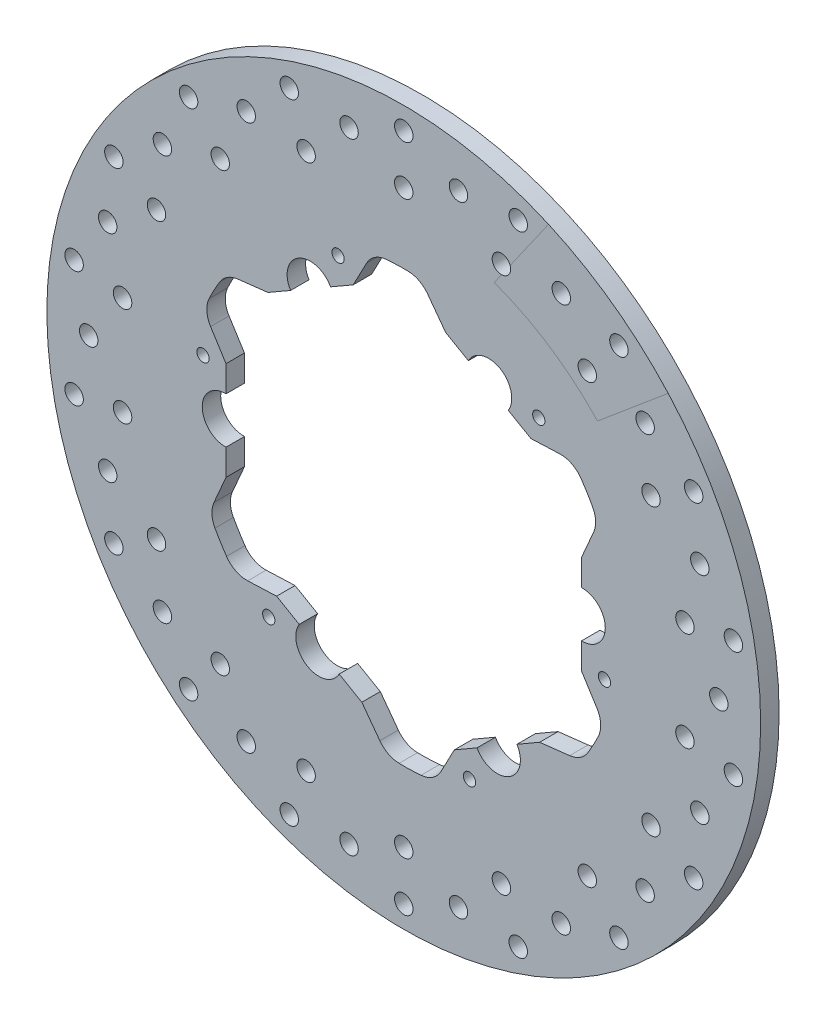
from build123d import *

# Parameters (mm, degrees)
SKETCH1_R             = 92.075
BOSS_EXTRUDE1_DEPTH   = 4.7625
FILLET1_R             = 6.35
SKETCH4_R             = 1.5875
CUT_EXTRUDE1_DEPTH    = 131.30077765
SKETCH5_R             = 2.38125
CUT_EXTRUDE2_DEPTH    = 131.30077765
FRONTPATERNCOPY_COUNT = 18


with BuildPart() as part:
    # Sketch1 → Boss-Extrude1 (new body)
    with BuildSketch(Plane.XY):
        with Locations(Location((0, 0, 0), (0, 0, 180))):
            Circle(SKETCH1_R)
        with BuildLine():
            Line((-45.8597, 4.659861673), (-45.8597, 11.409392412))
            Line((-45.8597, 11.409392412), (-51.623596361, 20.547401417))
            ThreePointArc((-51.623596361, 20.547401417), (-49.007713262, 26.180822124), (-45.779418198, 31.487081093))
            Line((-45.779418198, 31.487081093), (-35.046071586, 32.720361416))
            Line((-35.046071586, 32.720361416), (-29.200806502, 36.095126785))
            ThreePointArc((-29.200806502, 36.095126785), (-27.113011458, 44.379898214), (-18.894291413, 42.045596046))
            Line((-18.894291413, 42.045596046), (-13.04902633, 45.420361416))
            Line((-13.04902633, 45.420361416), (-8.017226572, 54.981046592))
            ThreePointArc((-8.017226572, 54.981046592), (-1.830599579, 55.532335728), (4.378903018, 55.389679676))
            Line((4.378903018, 55.389679676), (10.813628414, 46.710969004))
            Line((10.813628414, 46.710969004), (16.658893498, 43.336203635))
            ThreePointArc((16.658893498, 43.336203635), (24.877613542, 45.670505803), (26.965408587, 37.385734374))
            Line((26.965408587, 37.385734374), (32.81067367, 34.010969004))
            Line((32.81067367, 34.010969004), (43.606369789, 34.433645175))
            ThreePointArc((43.606369789, 34.433645175), (47.177113682, 29.351513604), (50.158321216, 23.902598583))
            Line((50.158321216, 23.902598583), (45.8597, 13.990607588))
            Line((45.8597, 13.990607588), (45.8597, 7.241076849))
            ThreePointArc((45.8597, 7.241076849), (51.990625, 1.290607588), (45.8597, -4.659861673))
            Line((45.8597, -4.659861673), (45.8597, -11.409392412))
            Line((45.8597, -11.409392412), (51.623596361, -20.547401417))
            ThreePointArc((51.623596361, -20.547401417), (49.007713262, -26.180822124), (45.779418198, -31.487081093))
            Line((45.779418198, -31.487081093), (35.046071586, -32.720361416))
            Line((35.046071586, -32.720361416), (29.200806502, -36.095126785))
            ThreePointArc((29.200806502, -36.095126785), (27.113011458, -44.379898214), (18.894291413, -42.045596046))
            Line((18.894291413, -42.045596046), (13.04902633, -45.420361416))
            Line((13.04902633, -45.420361416), (8.017226572, -54.981046592))
            ThreePointArc((8.017226572, -54.981046592), (1.830599579, -55.532335728), (-4.378903018, -55.389679676))
            Line((-4.378903018, -55.389679676), (-10.813628414, -46.710969004))
            Line((-10.813628414, -46.710969004), (-16.658893498, -43.336203635))
            ThreePointArc((-16.658893498, -43.336203635), (-24.877613542, -45.670505803), (-26.965408587, -37.385734374))
            Line((-26.965408587, -37.385734374), (-32.81067367, -34.010969004))
            Line((-32.81067367, -34.010969004), (-43.606369789, -34.433645175))
            ThreePointArc((-43.606369789, -34.433645175), (-47.177113682, -29.351513604), (-50.158321216, -23.902598583))
            Line((-50.158321216, -23.902598583), (-45.8597, -13.990607588))
            Line((-45.8597, -13.990607588), (-45.8597, -7.241076849))
            ThreePointArc((-45.8597, -7.241076849), (-51.990625, -1.290607588), (-45.8597, 4.659861673))
        make_face(mode=Mode.SUBTRACT)
    extrude(amount=BOSS_EXTRUDE1_DEPTH)

    # Fillet1
    fillet1_edges = [part.edges().sort_by_distance(p)[0] for p in [
        (-43.606369789, -34.433645175, 2.38125),
        (-4.378903018, -55.389679676, 2.38125),
        (8.017226572, -54.981046592, 2.38125),
        (45.779418198, -31.487081093, 2.38125),
        (51.623596361, -20.547401417, 2.38125),
        (50.158321216, 23.902598583, 2.38125),
        (43.606369789, 34.433645175, 2.38125),
        (4.378903018, 55.389679676, 2.38125),
        (-8.017226572, 54.981046592, 2.38125),
        (-45.779418198, 31.487081093, 2.38125),
        (-51.623596361, 20.547401417, 2.38125),
        (-50.158321216, -23.902598583, 2.38125),
    ]]
    fillet(fillet1_edges, radius=FILLET1_R)

    # Sketch4 → Cut-Extrude1 (cut, through all)
    with BuildSketch(Plane.XY.offset(4.7625)):
        with Locations((-16.953011458, 50.011322779)):
            Circle(SKETCH4_R)
        with Locations((34.834570274, 39.687399983)):
            Circle(SKETCH4_R)
        with Locations((51.787581732, -10.323922796)):
            Circle(SKETCH4_R)
        with Locations((16.953011458, -50.011322779)):
            Circle(SKETCH4_R)
        with Locations((-34.834570274, -39.687399983)):
            Circle(SKETCH4_R)
        with Locations((-51.787581732, 10.323922796)):
            Circle(SKETCH4_R)
    extrude(amount=-CUT_EXTRUDE1_DEPTH, mode=Mode.SUBTRACT)

    # Sketch5 → Cut-Extrude2 (cut, through all)
    with BuildSketch(Plane.XY.offset(4.7625)):
        with Locations((0, 86.36)):
            Circle(SKETCH5_R)
        with Locations((0, 73.66)):
            Circle(SKETCH5_R)
        with Locations((14.114123881, 80.045174165)):
            Circle(SKETCH5_R)
    cut_extrude2 = extrude(amount=-CUT_EXTRUDE2_DEPTH, mode=Mode.SUBTRACT)

    # FrontPaternCopy: Cut-Extrude2 ×18 about axis
    frontpaterncopy_axis = Axis((0, 0, 0), (0, 0, 1))
    for i in range(1, FRONTPATERNCOPY_COUNT):
        add(cut_extrude2.rotate(frontpaterncopy_axis, i * 360 / FRONTPATERNCOPY_COUNT), mode=Mode.SUBTRACT)


solid = part.part
